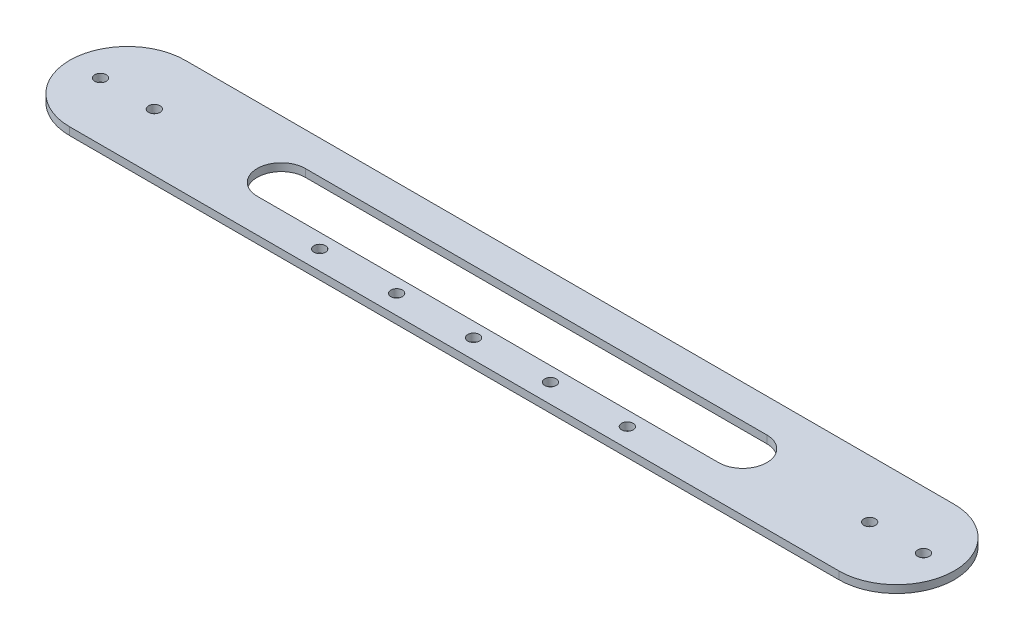
from build123d import *

# Parameters (mm, degrees)
EXTRUDE_1_DEPTH     = 2
SKETCH_4_R          = 1.5
CUT_EXTRUDE_1_DEPTH = 2


with BuildPart() as part:
    # 草图1 → 凸台-拉伸1 (new body)
    with BuildSketch(Plane(origin=(0, 0, 0), x_dir=(1, 0, 0), z_dir=(0, 1, 0))):
        with BuildLine():
            Line((-100, 15), (100, 15))
            ThreePointArc((100, 15), (115, 0), (100, -15))
            Line((100, -15), (-100, -15))
            ThreePointArc((-100, -15), (-115, 0), (-100, 15))
        make_face()
    extrude(amount=EXTRUDE_1_DEPTH)

    # 草图4 → 切除-拉伸1 (cut)
    with BuildSketch(Plane(origin=(0, 2, 0), x_dir=(1, 0, 0), z_dir=(0, 1, 0))):
        with Locations(Location((-107, 0, 0), (0, 0, 270))):
            Circle(SKETCH_4_R)
        with Locations(Location((-93, 0, 0), (0, 0, 270))):
            Circle(SKETCH_4_R)
        with Locations(Location((107, 0, 0), (0, 0, 90))):
            Circle(SKETCH_4_R)
        with Locations(Location((93, 0, 0), (0, 0, 90))):
            Circle(SKETCH_4_R)
        with Locations(Location((0, -10, 0), (0, 0, 270))):
            Circle(SKETCH_4_R)
        with Locations(Location((20, -10, 0), (0, 0, 270))):
            Circle(SKETCH_4_R)
        with Locations(Location((40, -10, 0), (0, 0, 270))):
            Circle(SKETCH_4_R)
        with Locations(Location((-20, -10, 0), (0, 0, 270))):
            Circle(SKETCH_4_R)
        with Locations(Location((-40, -10, 0), (0, 0, 270))):
            Circle(SKETCH_4_R)
        with BuildLine():
            Line((-60, 6.25), (60, 6.25))
            ThreePointArc((60, 6.25), (66.25, 0), (60, -6.25))
            Line((60, -6.25), (-60, -6.25))
            ThreePointArc((-60, -6.25), (-66.25, 0), (-60, 6.25))
        make_face()
    extrude(amount=-CUT_EXTRUDE_1_DEPTH, mode=Mode.SUBTRACT)


solid = part.part
